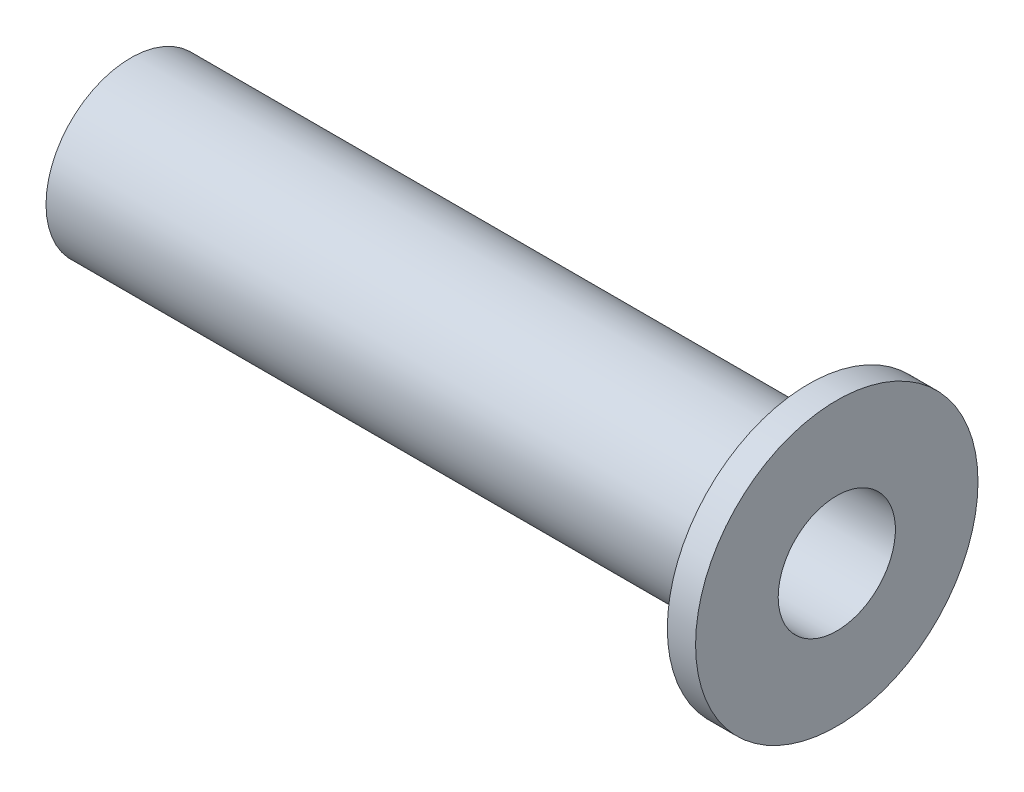
from build123d import *


with BuildPart() as part:
    # Эскиз1 → Повернуть1 (revolve)
    with BuildSketch(Plane.XY, mode=Mode.PRIVATE) as revolve_1_sk:
        Polygon((-84.15266755, 4.15), (-34.15266755, 4.15), (-34.15266755, 10), (-36.15266755, 10), (-36.15266755, 6), (-84.15266755, 6), align=None)
    revolve(revolve_1_sk.sketch.rotate(Axis((-92.810349397, 0, 0), (1, 0, 0)), 90), axis=Axis((-92.810349397, 0, 0), (1, 0, 0)))


solid = part.part
